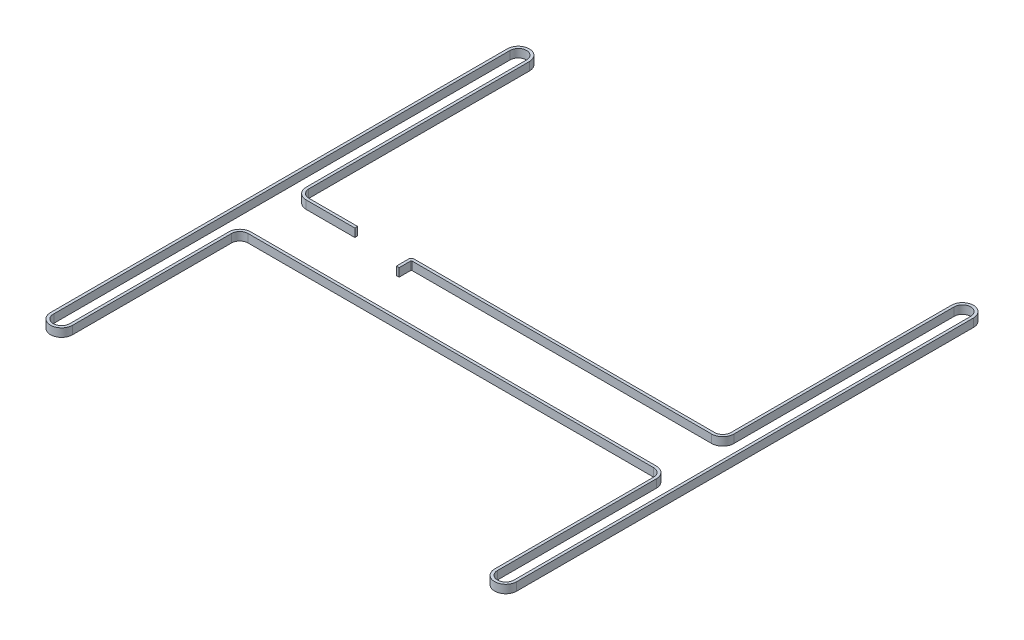
from build123d import *

# Parameters (mm, degrees)
BOSS_EXTRUDE2_DEPTH = 6


with BuildPart() as part:
    # Sketch1 → Boss-Extrude2 (new body)
    with BuildSketch(Plane(origin=(0, 0, 0), x_dir=(1, 0, 0), z_dir=(0, 1, 0))):
        with BuildLine():
            Line((7.988162854, 331.501326389), (7.988162854, 171.337454215))
            ThreePointArc((7.988162854, 171.337454215), (9.818693497, 167.235107296), (13.984274361, 165.553432905))
            Line((13.984274361, 165.553432905), (49.307855037, 165.553432905))
            Line((49.307855037, 165.553432905), (49.307855037, 163.543518894))
            Line((49.307855037, 163.543518894), (13.984274361, 163.543518894))
            ThreePointArc((13.984274361, 163.543518894), (8.320398521, 165.889579716), (5.974360349, 171.553464938))
            Line((5.974360349, 171.553464938), (5.974999998, 331.501302447))
            ThreePointArc((5.974999998, 331.501302447), (-0.011825567, 337.488163533), (-5.998674291, 331.501325605))
            Line((-5.998674291, 331.501325605), (-5.998674291, 0.561440532))
            ThreePointArc((-5.998674291, 0.561440532), (-0.306028697, -5.993414959), (5.975, 0))
            Line((5.975, 0), (5.975, 115.356719051))
            ThreePointArc((5.975, 115.356719051), (8.250227281, 120.944829403), (13.781744328, 123.354384475))
            Line((13.781744328, 123.354384475), (308.33721248, 123.354384475))
            ThreePointArc((308.33721248, 123.354384475), (313.994066729, 121.011238725), (316.33721248, 115.354384475))
            Line((316.33721248, 115.354384475), (316.33721248, 0.000205216))
            ThreePointArc((316.33721248, 0.000205216), (322.337222061, -5.999794784), (328.33721248, 0.000224379))
            Line((328.33721248, 0.000224379), (328.336683355, 331.50001256))
            ThreePointArc((328.336683355, 331.50001256), (322.26179375, 337.500094056), (316.337490676, 331.351281588))
            Line((316.337490676, 331.351281588), (316.337490676, 171.552255024))
            ThreePointArc((316.337490676, 171.552255024), (313.994332551, 165.895370899), (308.337448427, 163.552212774))
            Line((308.337448427, 163.552212774), (90.793200611, 163.552212774))
            ThreePointArc((90.793200611, 163.552212774), (90.43964722, 163.405766165), (90.293200611, 163.052212774))
            Line((90.293200611, 163.052212774), (90.293200611, 157.424591987))
            Line((90.293200611, 157.424591987), (90.293200611, 154.657877928))
            Line((90.293200611, 154.657877928), (88.293002078, 154.657877928))
            Line((88.293002078, 154.657877928), (88.293002078, 157.424591987))
            Line((88.293002078, 157.424591987), (88.293002078, 163.552212774))
            ThreePointArc((88.293002078, 163.552212774), (88.878788516, 164.966468586), (90.293002078, 165.552255024))
            Line((90.293002078, 165.552255024), (308.337448427, 165.552255024))
            ThreePointArc((308.337448427, 165.552255024), (312.580089114, 167.309614337), (314.337448427, 171.552255024))
            Line((314.337448427, 171.552255024), (314.337448427, 331.693156944))
            ThreePointArc((314.337448427, 331.693156944), (322.432732181, 339.500501309), (330.33721248, 331.500036554))
            Line((330.33721248, 331.500036554), (330.33721248, 0.000205216))
            ThreePointArc((330.33721248, 0.000205216), (322.33721248, -7.999794784), (314.33721248, 0.000205216))
            Line((314.33721248, 0.000205216), (314.33721248, 115.354384475))
            ThreePointArc((314.33721248, 115.354384475), (312.579853167, 119.597025163), (308.33721248, 121.354384475))
            Line((308.33721248, 121.354384475), (13.975047586, 121.356719051))
            ThreePointArc((13.975047586, 121.356719051), (9.732376137, 119.599376562), (7.975, 115.356719051))
            Line((7.975, 115.356719051), (7.975, 0))
            ThreePointArc((7.975, 0), (-0.025317655, -7.999999994), (-8.024999975, 0.000635309))
            Line((-8.024999975, 0.000635309), (-8.011837146, 331.501326389))
            ThreePointArc((-8.011837146, 331.501326389), (-0.011837146, 339.501326389), (7.988162854, 331.501326389))
        make_face()
    extrude(amount=BOSS_EXTRUDE2_DEPTH)


solid = part.part
